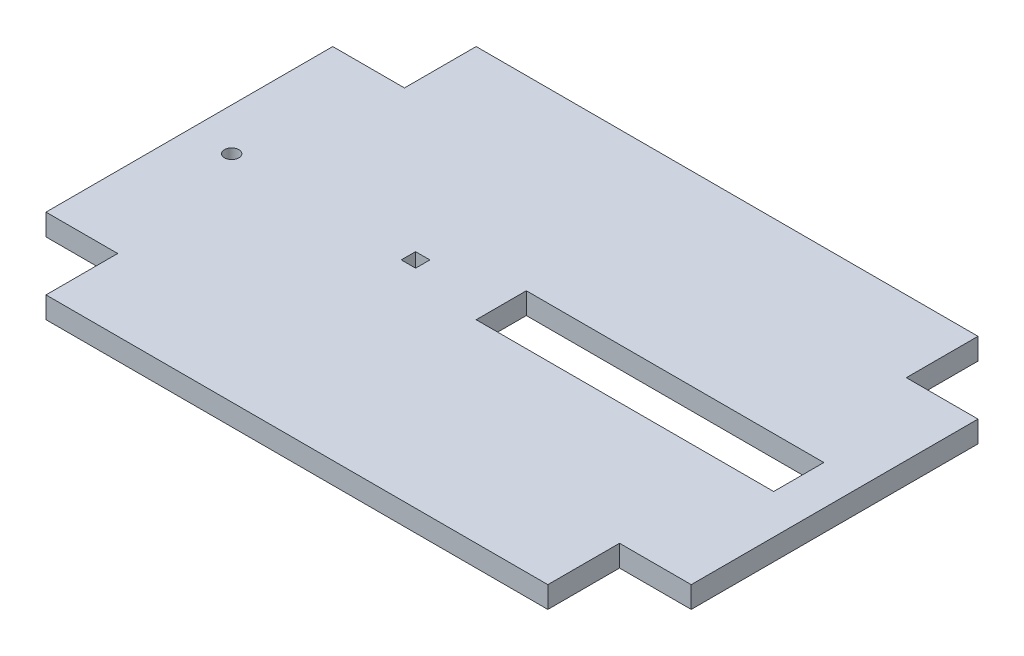
from build123d import *

# Parameters (mm, degrees)
SKETCH1_W           = 900
SKETCH1_H           = 600
BOSS_EXTRUDE1_DEPTH = 30
SKETCH2_W           = 100
SKETCH2_H           = 100
CUT_EXTRUDE1_DEPTH  = 623.016629111
SKETCH4_R           = 10
SKETCH4_W           = 20
SKETCH4_H           = 20
CUT_EXTRUDE2_DEPTH  = 176
SKETCH5_W           = 415
SKETCH5_H           = 70
CUT_EXTRUDE3_DEPTH  = 110


with BuildPart() as part:
    # Sketch1 → Boss-Extrude1 (new body)
    with BuildSketch(Plane(origin=(0, 0, 0), x_dir=(1, 0, 0), z_dir=(0, 1, 0))):
        with Locations((48.214762953, -71.196358908)):
            Rectangle(SKETCH1_W, SKETCH1_H)
    extrude(amount=BOSS_EXTRUDE1_DEPTH)

    # Sketch2 → Cut-Extrude1 (cut, through all)
    with BuildSketch(Plane(origin=(0, 30, 0), x_dir=(1, 0, 0), z_dir=(0, 1, 0))):
        with Locations((-351.785237047, 178.803641092)):
            Rectangle(SKETCH2_W, SKETCH2_H)
        with Locations((-351.785237047, -321.196358908)):
            Rectangle(SKETCH2_W, SKETCH2_H)
        with Locations((448.214762953, -321.196358908)):
            Rectangle(SKETCH2_W, SKETCH2_H)
        with Locations((448.214762953, 178.803641092)):
            Rectangle(SKETCH2_W, SKETCH2_H)
    extrude(amount=-CUT_EXTRUDE1_DEPTH, mode=Mode.SUBTRACT)

    # Sketch4 → Cut-Extrude2 (cut)
    with BuildSketch(Plane(origin=(0, 30, 0), x_dir=(1, 0, 0), z_dir=(0, 1, 0))):
        with Locations(Location((-342.785237047, -71.196358908, 0), (0, 0, 270))):
            Circle(SKETCH4_R)
        with Locations((-86.285237047, -71.196358908)):
            Rectangle(SKETCH4_W, SKETCH4_H)
    extrude(amount=-CUT_EXTRUDE2_DEPTH, mode=Mode.SUBTRACT)

    # Sketch5 → Cut-Extrude3 (cut)
    with BuildSketch(Plane(origin=(0, 30, 0), x_dir=(1, 0, 0), z_dir=(0, 1, 0))):
        with Locations((235.714762953, -66.196358908)):
            Rectangle(SKETCH5_W, SKETCH5_H)
    extrude(amount=-CUT_EXTRUDE3_DEPTH, mode=Mode.SUBTRACT)


solid = part.part
